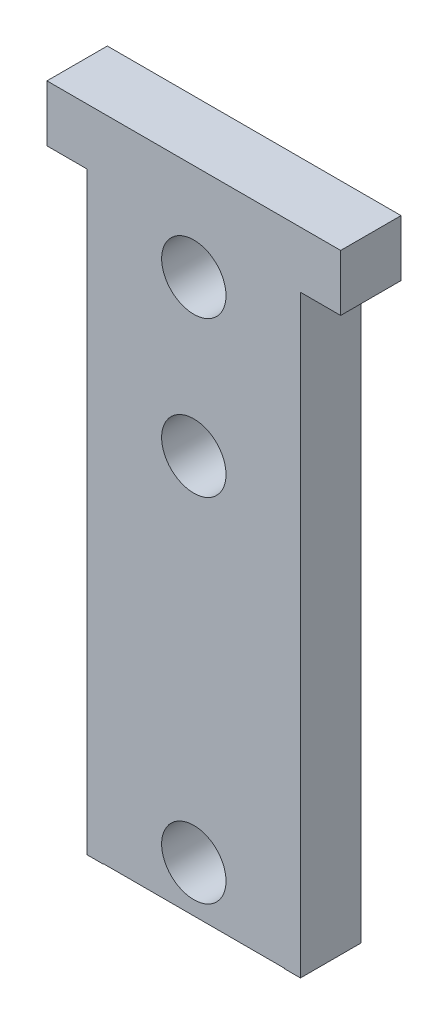
from build123d import *

# Parameters (mm, degrees)
SKIZZE1_W                       = 2.5
SKIZZE1_H                       = 3
SKIZZE1_W_2                     = 7
SKIZZE1_H_2                     = 7
SKIZZE1_R                       = 1.25
SKIZZE1_H_3                     = 22.5
SKIZZE1_R_2                     = 1.5
AUFSATZ_LINEAR_AUSTRAGEN1_DEPTH = 3
SKIZZE2_W                       = 2
SKIZZE2_H                       = 29.5
SKIZZE2_W_2                     = 1.5
SKIZZE2_H_2                     = 3
AUFSATZ_LINEAR_AUSTRAGEN2_DEPTH = 3
SKIZZE3_W                       = 1
SKIZZE3_H                       = 1
SKIZZE3_H_2                     = 2
SKIZZE3_W_2                     = 13
SKIZZE3_H_3                     = 29.5
SCHNITT_LINEAR_AUSTRAGEN1_DEPTH = 10
SKIZZE4_W                       = 0.8
SKIZZE4_H                       = 1.999250504
SKIZZE4_H_2                     = 2
AUFSATZ_LINEAR_AUSTRAGEN3_DEPTH = 3
SKIZZE5_R                       = 1.6
SCHNITT_LINEAR_AUSTRAGEN2_DEPTH = 3


with BuildPart() as part:
    # Skizze1 → Aufsatz-Linear austragen1 (new body)
    # profile 1 of 5: a face of its own
    with BuildSketch(Plane.XY):
        with Locations((4.75, 14.75)):
            Rectangle(SKIZZE1_W, SKIZZE1_H)
    # profile 2 of 5: a face of its own
    with BuildSketch(Plane.XY):
        with Locations((0, 14.75)):
            Rectangle(SKIZZE1_W_2, SKIZZE1_H)
    # profile 3 of 5: a face of its own
    with BuildSketch(Plane.XY):
        with Locations((-4.75, 14.75)):
            Rectangle(SKIZZE1_W, SKIZZE1_H)
    # profile 4 of 5: a face of its own
    with BuildSketch(Plane.XY):
        with Locations((0, 9.75)):
            Rectangle(SKIZZE1_W_2, SKIZZE1_H_2)
        with Locations((0, 11.25)):
            Circle(SKIZZE1_R, mode=Mode.SUBTRACT)
    # profile 5 of 5: a face of its own
    with BuildSketch(Plane.XY):
        with Locations((0, -5)):
            Rectangle(SKIZZE1_W_2, SKIZZE1_H_3)
        with Locations((0, -13.95)):
            Circle(SKIZZE1_R_2, mode=Mode.SUBTRACT)
        with Locations((0, 3.55)):
            Circle(SKIZZE1_R_2, mode=Mode.SUBTRACT)
    extrude(amount=AUFSATZ_LINEAR_AUSTRAGEN1_DEPTH)

    # Skizze2 → Aufsatz-Linear austragen2 (add)
    with BuildSketch(Plane(origin=(0, 0, 0), x_dir=(-1, 0, 0), z_dir=(0, 0, -1))):
        with Locations((-4.5, -1.5)):
            Rectangle(SKIZZE2_W, SKIZZE2_H)
        with Locations((4.5, -1.5)):
            Rectangle(SKIZZE2_W, SKIZZE2_H)
        with Locations((6.75, 14.75)):
            Rectangle(SKIZZE2_W_2, SKIZZE2_H_2)
        with Locations((-6.75, 14.75)):
            Rectangle(SKIZZE2_W_2, SKIZZE2_H_2)
    extrude(amount=-AUFSATZ_LINEAR_AUSTRAGEN2_DEPTH)

    # Skizze3 → Schnitt-Linear austragen1 (cut)
    with BuildSketch(Plane.XY.offset(3)):
        with Locations((-7, 15.75)):
            Rectangle(SKIZZE3_W, SKIZZE3_H)
        with Locations((-7, 14.25)):
            Rectangle(SKIZZE3_W, SKIZZE3_H_2)
        with Locations((0, 15.75)):
            Rectangle(SKIZZE3_W_2, SKIZZE3_H)
        with Locations((7, 15.75)):
            Rectangle(SKIZZE3_W, SKIZZE3_H)
        with Locations((7, 14.25)):
            Rectangle(SKIZZE3_W, SKIZZE3_H_2)
        with Locations((5, -1.5)):
            Rectangle(SKIZZE3_W, SKIZZE3_H_3)
        with Locations((-5, -1.5)):
            Rectangle(SKIZZE3_W, SKIZZE3_H_3)
    extrude(amount=-SCHNITT_LINEAR_AUSTRAGEN1_DEPTH, mode=Mode.SUBTRACT)

    # Skizze4 → Aufsatz-Linear austragen3 (add)
    with BuildSketch(Plane.XY.offset(3)):
        Polygon((-7.3, 15.25), (-7.3, 16.05), (7.3, 16.05), (7.3, 15.25), (6.5, 15.25), (-6.5, 15.25), align=None)
        with Locations((-6.9, 14.250374748)):
            Rectangle(SKIZZE4_W, SKIZZE4_H)
        Polygon((-4.5, 13.25), (-5.3, 13.25), (-5.3, -16.271198208), (-4.5, -16.271198208), (-4.5, -16.25), align=None)
        Polygon((5.3, -16.271198208), (5.3, 13.25), (4.5, 13.25), (4.5, -16.25), (4.5, -16.271198208), align=None)
        with Locations((6.9, 14.25)):
            Rectangle(SKIZZE4_W, SKIZZE4_H_2)
    extrude(amount=-AUFSATZ_LINEAR_AUSTRAGEN3_DEPTH)

    # Skizze5 → Schnitt-Linear austragen2 (cut)
    with BuildSketch(Plane.XY.offset(3)):
        with Locations((0, 11.25)):
            Circle(SKIZZE5_R)
        with Locations((0, 3.55)):
            Circle(SKIZZE5_R)
        with Locations((0, -13.95)):
            Circle(SKIZZE5_R)
    extrude(amount=-SCHNITT_LINEAR_AUSTRAGEN2_DEPTH, mode=Mode.SUBTRACT)


solid = part.part
